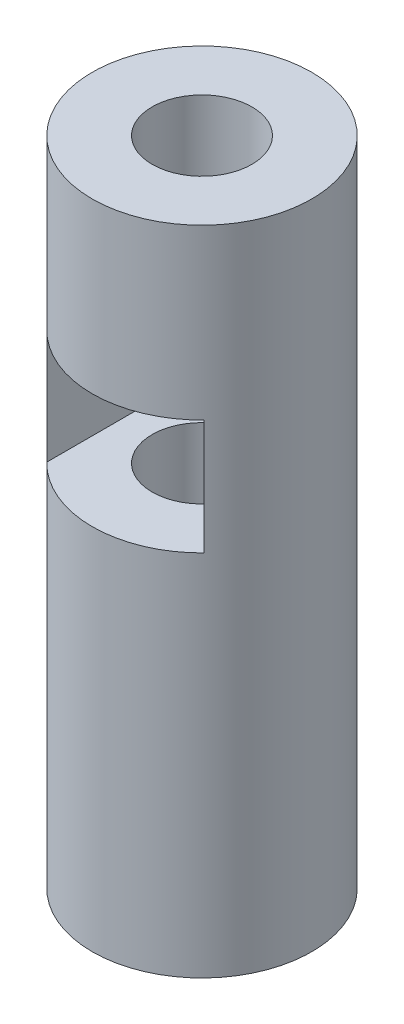
from build123d import *

# Parameters (mm, degrees)
SKETCH1_R           = 5.725
SKETCH1_R_2         = 3
BOSS_EXTRUDE1_DEPTH = 34
SKETCH2_R           = 5.725
BOSS_EXTRUDE2_DEPTH = 34
SKETCH3_R           = 2.6
CUT_EXTRUDE1_DEPTH  = 40
CUT_EXTRUDE2_DEPTH  = 4.7
SKETCH5_W           = 8.2
SKETCH5_H           = 4.7
CUT_EXTRUDE3_DEPTH  = 10
CUT_EXTRUDE10_DEPTH = 6


with BuildPart() as part:
    # Sketch1 → Boss-Extrude1 (new body)
    with BuildSketch(Plane(origin=(0, 0, 0), x_dir=(1, 0, 0), z_dir=(0, 1, 0))):
        with Locations(Location((0, 0, 0), (0, 0, 270))):
            Circle(SKETCH1_R)
        with Locations(Location((0, 0, 0), (0, 0, 270))):
            Circle(SKETCH1_R_2, mode=Mode.SUBTRACT)
    extrude(amount=BOSS_EXTRUDE1_DEPTH)

    # Sketch2 → Boss-Extrude2 (add)
    with BuildSketch(Plane(origin=(0, 0, 0), x_dir=(-1, 0, 0), z_dir=(0, -1, 0))):
        with Locations(Location((0, 0, 0), (0, 0, 270))):
            Circle(SKETCH2_R)
    extrude(amount=-BOSS_EXTRUDE2_DEPTH)

    # Sketch3 → Cut-Extrude1 (cut)
    with BuildSketch(Plane(origin=(0, 0, 0), x_dir=(-1, 0, 0), z_dir=(0, -1, 0))):
        with Locations(Location((0, 0, 0), (0, 0, 90))):
            Circle(SKETCH3_R)
    extrude(amount=-CUT_EXTRUDE1_DEPTH, mode=Mode.SUBTRACT)

    # Sketch4 → Cut-Extrude2 (cut)
    with BuildSketch(Plane(origin=(0, 7.2, 0), x_dir=(1, 0, 0), z_dir=(0, 1, 0))):
        Polygon((0, -4.734272207), (4.1, -2.367136104), (4.1, 2.367136104), (0, 4.734272207), (-4.1, 2.367136104), (-4.1, -2.367136104), align=None)
    extrude(amount=-CUT_EXTRUDE2_DEPTH, mode=Mode.SUBTRACT)

    # Sketch5 → Cut-Extrude3 (cut)
    with BuildSketch(Plane.XY):
        with Locations((0, 4.85)):
            Rectangle(SKETCH5_W, SKETCH5_H)
    extrude(amount=-CUT_EXTRUDE3_DEPTH, mode=Mode.SUBTRACT)

    # Sketch6 → Cut-Extrude10 (cut)
    with BuildSketch(Plane(origin=(0, 19.2, 0), x_dir=(1, 0, 0), z_dir=(0, 1, 0))):
        Polygon((-4.1, 2.367136104), (-4.1, -6.0044428), (-4.1, -15.659528102), (4.1, -15.659528102), (4.1, -2.367136104), (4.1, 2.367136104), align=None)
        Polygon((4.1, 2.367136104), (-4.1, 2.367136104), (0, 4.734272207), align=None)
    extrude(amount=CUT_EXTRUDE10_DEPTH, mode=Mode.SUBTRACT)


solid = part.part
